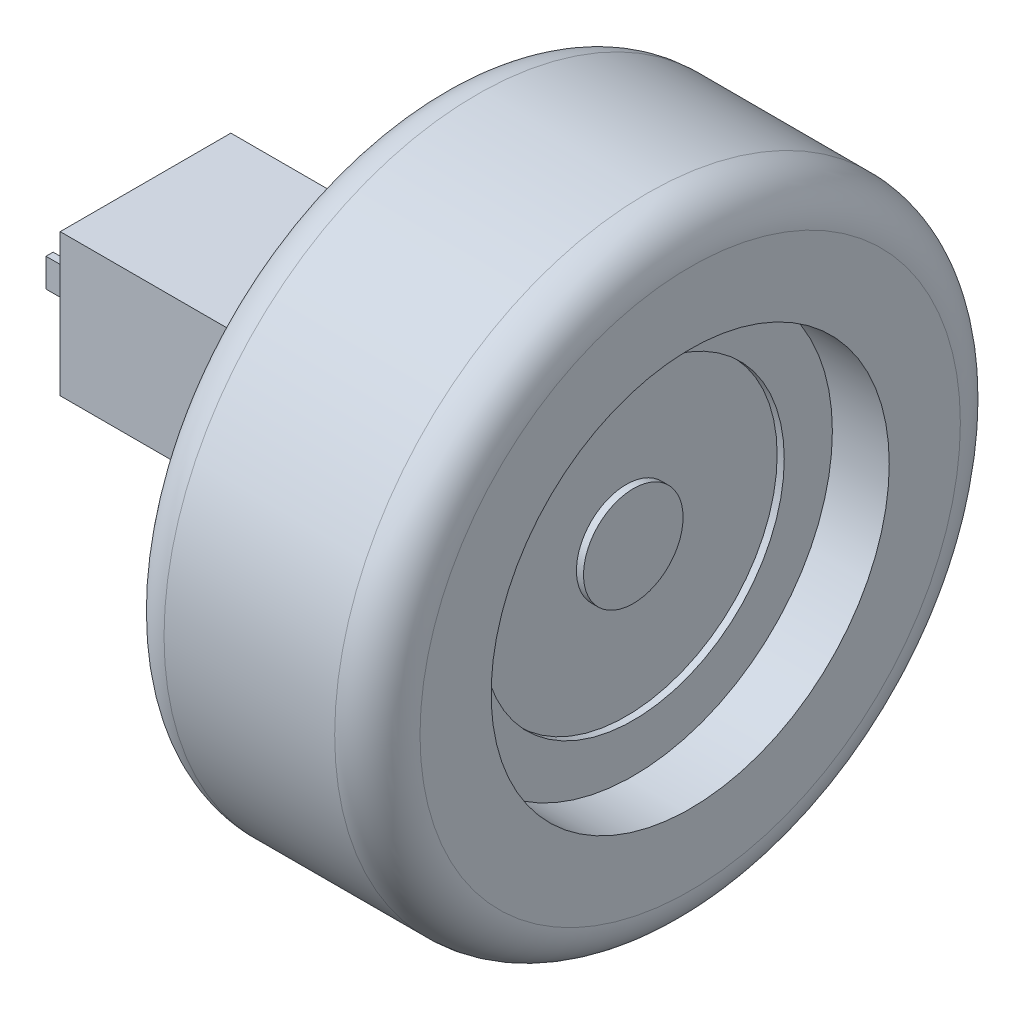
from build123d import *

# Parameters (mm, degrees)
SKETCH_8_W            = 12
SKETCH_8_H            = 10
EXTRUDE_1_DEPTH       = 24.3
SKETCH_10_R           = 1.5
EXTRUDE_2_DEPTH       = 5
SKETCH_11_R           = 2
EXTRUDE_3_DEPTH       = 0.8
SKETCH_12_R           = 2.5
EXTRUDE_4_DEPTH       = 1
SKETCH_13_R           = 22
EXTRUDE_1_2_DEPTH     = 9
SKETCH_15_R           = 14
CUT_EXTRUDE_3_DEPTH   = 4
SKETCH_16_R           = 22
SKETCH_16_R_2         = 14
EXTRUDE_7_DEPTH       = 9
SKETCH_17_W           = 2.3
SKETCH_17_H           = 12
CUT_EXTRUDE_3_2_DEPTH = 12
SKETCH_18_R           = 1
SKETCH_18_R_2         = 1.5
SKETCH_18_R_3         = 2.8
EXTRUDE_8_DEPTH       = 3
FILLET_1_R            = 3
FILLET_2_R            = 3
SKETCH_20_W           = 0.5
SKETCH_20_H           = 2
EXTRUDE_9_DEPTH       = 3
SKETCH_21_R           = 10.617088877
SKETCH_21_R_2         = 3.5
CUT_EXTRUDE_5_DEPTH   = 0.5


with BuildPart() as part:
    # 草图8 → Extrude 1 (new body)
    with BuildSketch(Plane(origin=(0, 0, 0), x_dir=(0, 0, -1), z_dir=(1, 0, 0))):
        Rectangle(SKETCH_8_W, SKETCH_8_H)
    extrude(amount=EXTRUDE_1_DEPTH)

    # 草图10 → 电机2 (add)
    with BuildSketch(Plane(origin=(24.3, 0, 0), x_dir=(0, 0, -1), z_dir=(1, 0, 0))):
        Circle(SKETCH_10_R)
    extrude(amount=EXTRUDE_2_DEPTH)

    # 草图11 → 电机3 (add)
    with BuildSketch(Plane(origin=(24.3, 0, 0), x_dir=(0, 0, -1), z_dir=(1, 0, 0))):
        with Locations((0.037058569, 0)):
            Circle(SKETCH_11_R)
    extrude(amount=EXTRUDE_3_DEPTH)

    # 草图12 → 电机4 (add)
    with BuildSketch(Plane.ZY):
        Circle(SKETCH_12_R)
    extrude(amount=EXTRUDE_4_DEPTH)

    # 草图13 → Extrude 1 2 (add)
    with BuildSketch(Plane(origin=(29.3, 0, 0), x_dir=(0, 0, -1), z_dir=(1, 0, 0))):
        Circle(SKETCH_13_R)
    extrude(amount=EXTRUDE_1_2_DEPTH)

    # 草图15 → Cut-Extrude 3 (cut)
    with BuildSketch(Plane(origin=(38.3, 0, 0), x_dir=(0, 0, -1), z_dir=(1, 0, 0))):
        Circle(SKETCH_15_R)
    extrude(amount=-CUT_EXTRUDE_3_DEPTH, mode=Mode.SUBTRACT)

    # 草图16 → 凸台-拉伸7 (add)
    with BuildSketch(Plane.ZY.offset(-29.3)):
        Circle(SKETCH_16_R)
        Circle(SKETCH_16_R_2, mode=Mode.SUBTRACT)
    extrude(amount=EXTRUDE_7_DEPTH)

    # 草图17 → Cut-Extrude 3 2 (cut)
    with BuildSketch(Plane(origin=(0, 5, 0), x_dir=(1, 0, 0), z_dir=(0, 1, 0))):
        with Locations((17.15, 0)):
            Rectangle(SKETCH_17_W, SKETCH_17_H)
    extrude(amount=-CUT_EXTRUDE_3_2_DEPTH, mode=Mode.SUBTRACT)


with BuildPart() as cut_extrude_3_2_piece_1:
    # of the separate pieces the step leaves, piece 1, a body of its own (cut_extrude_3_2_pieces)
    add(part.part.solids().sort_by_distance((29.3, 0, -22))[0])



with BuildPart() as cut_extrude_3_2_piece_2:
    # of the separate pieces the step leaves, piece 2, a body of its own (cut_extrude_3_2_pieces)
    add(part.part.solids().sort_by_distance((0, 5, 6))[0])


with BuildPart() as cut_extrude_3_2_piece_1_1:
    add(cut_extrude_3_2_piece_1.part)

    add(cut_extrude_3_2_piece_2.part)  # 凸台-拉伸8 merges Cut-Extrude 3 2 piece 2
    # 草图18 → 凸台-拉伸8 (add)
    with BuildSketch(Plane.ZY.offset(-18.3)):
        Circle(SKETCH_18_R)
        with Locations((3.6, 3)):
            Circle(SKETCH_18_R_2)
        with Locations((-3.6, -3)):
            Circle(SKETCH_18_R_2)
        with Locations(Location((-3.2, 2.2, 0), (0, 0, 180))):
            Circle(SKETCH_18_R_3)
    extrude(amount=EXTRUDE_8_DEPTH)

    # 圆角1
    fillet_1_edges = [cut_extrude_3_2_piece_1_1.edges().sort_by_distance(p)[0] for p in [
        (38.3, 0, 22),
    ]]
    fillet(fillet_1_edges, radius=FILLET_1_R)

    # 圆角2
    fillet_2_edges = [cut_extrude_3_2_piece_1_1.edges().sort_by_distance(p)[0] for p in [
        (20.3, 0, -22),
    ]]
    fillet(fillet_2_edges, radius=FILLET_2_R)

    # 草图20 → 凸台-拉伸9 (add)
    with BuildSketch(Plane.ZY):
        with Locations((3.75, 0)):
            Rectangle(SKETCH_20_W, SKETCH_20_H)
        with Locations((-3.75, 0)):
            Rectangle(SKETCH_20_W, SKETCH_20_H)
    extrude(amount=EXTRUDE_9_DEPTH)

    # 草图21 → 切除-拉伸5 (cut)
    with BuildSketch(Plane(origin=(34.3, 0, 0), x_dir=(0, 0, -1), z_dir=(1, 0, 0))):
        Circle(SKETCH_21_R)
        Circle(SKETCH_21_R_2, mode=Mode.SUBTRACT)
    extrude(amount=-CUT_EXTRUDE_5_DEPTH, mode=Mode.SUBTRACT)


solid = cut_extrude_3_2_piece_1_1.part
